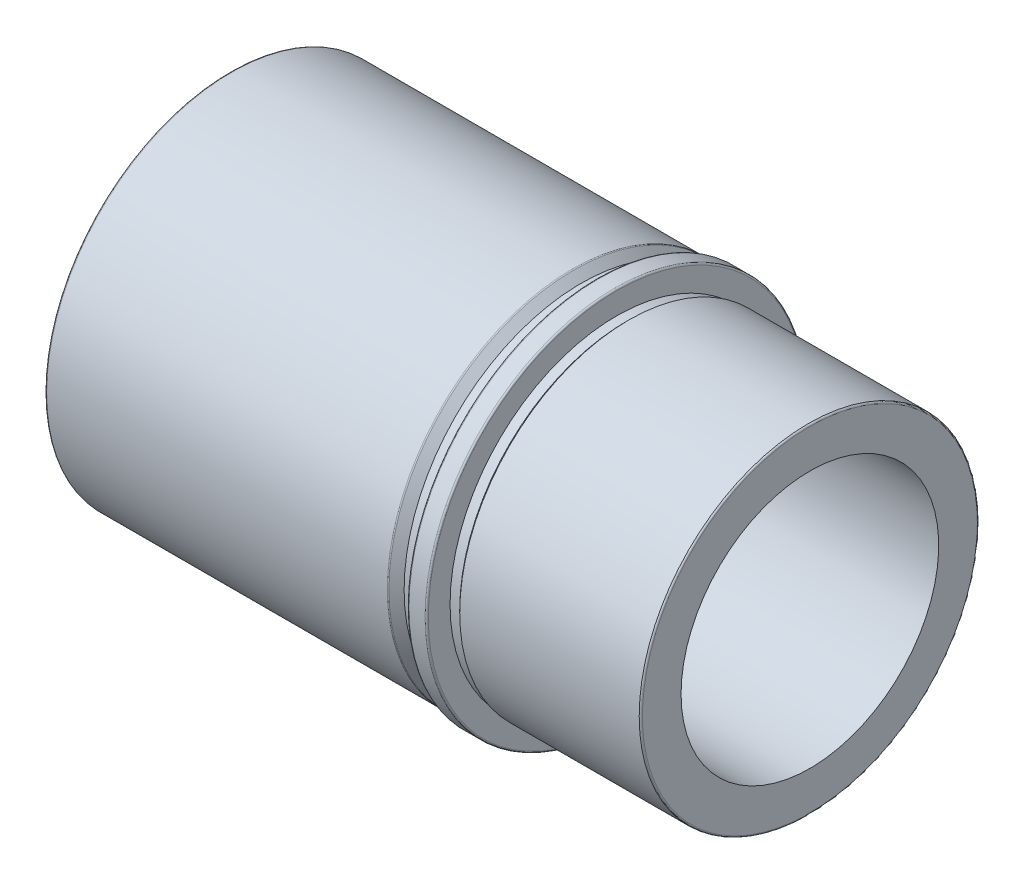
from build123d import *

# Parameters (mm, degrees)
FILLET1_R = 0.5


with BuildPart() as part:
    # Sketch1 → Base-Revolve (revolve)
    with BuildSketch(Plane.XY, mode=Mode.PRIVATE) as base_revolve_sk:
        Polygon((-114, -57.5), (-7.5, -57.5), (-5, -55), (0, -55), (0, -59), (6, -59), (6, -51.733365662), (9, -51.733365662), (9.766634338, -52.5), (66, -52.5), (66, -40), (-114, -40), align=None)
    revolve(base_revolve_sk.sketch.rotate(Axis((-138.758229417, 0, 0), (1, 0, 0)), 270), axis=Axis((-138.758229417, 0, 0), (1, 0, 0)))

    # Fillet1
    fillet1_edges = [part.edges().sort_by_distance(p)[0] for p in [
        (6, 0, -59),
        (0, 0, -59),
        (-7.5, 0, -57.5),
        (-114, 0, -57.5),
        (-114, 0, -40),
        (66, 0, -52.5),
    ]]
    fillet(fillet1_edges, radius=FILLET1_R)


solid = part.part
